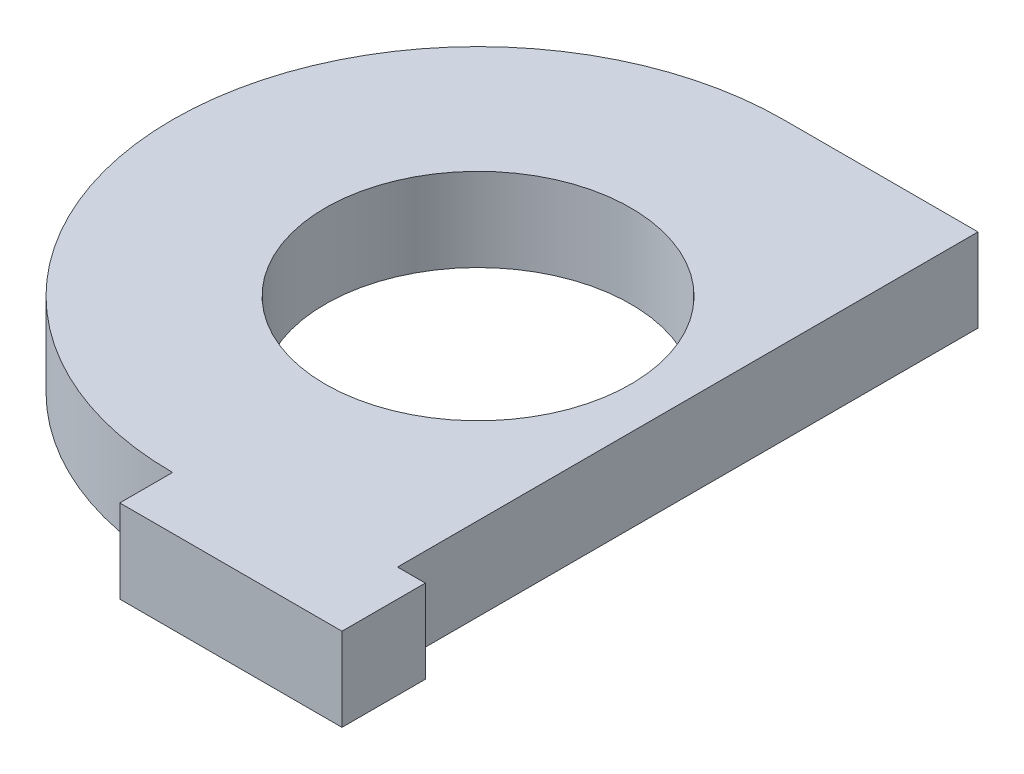
from build123d import *

# Parameters (mm, degrees)
SKETCH1_R           = 11
BOSS_EXTRUDE1_DEPTH = 6


with BuildPart() as part:
    # Sketch1 → Boss-Extrude1 (new body)
    with BuildSketch(Plane(origin=(0, 0, 0), x_dir=(1, 0, 0), z_dir=(0, 1, 0))):
        with BuildLine():
            Line((0, 0), (0, 41.8))
            Line((0, 41.8), (-14, 41.8))
            ThreePointArc((-14, 41.8), (-36, 19.8), (-14, -2.2))
            Line((-14, -2.2), (-14, -6))
            Line((-14, -6), (2, -6))
            Line((2, -6), (2, 0))
            Line((2, 0), (0, 0))
        make_face()
        with Locations(Location((-14, 19.8, 0), (0, 0, 270))):
            Circle(SKETCH1_R, mode=Mode.SUBTRACT)
    extrude(amount=BOSS_EXTRUDE1_DEPTH)


solid = part.part
